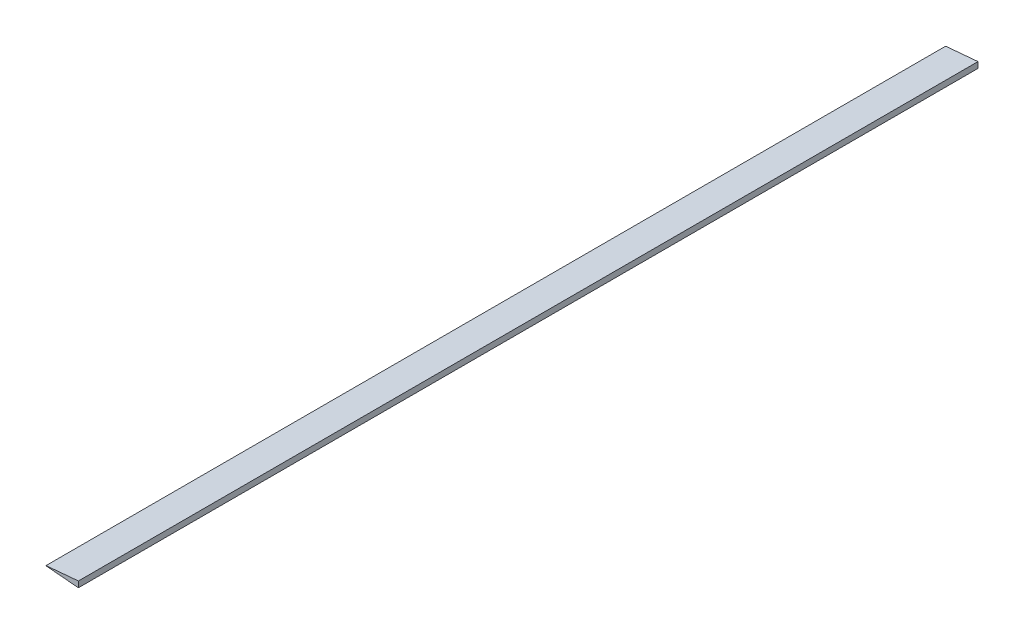
from build123d import *

# Parameters (mm, degrees)
BOSS_EXTRUDE1_DEPTH = 422.9


with BuildPart() as part:
    # Sketch1 → Boss-Extrude1 (new, symmetric)
    with BuildSketch(Plane.XY):
        with BuildLine():
            Line((-71.0668, 2.788978681), (-71.0668, -2.788978681))
            add(Edge.make_bspline(
                [(-71.0668, -2.788978681), (-71.180789757, -2.780935505), (-72.873449735, -2.661500548), (-76.05100549, -2.415421445), (-80.490955936, -2.060949656), (-84.605020273, -1.712894337), (-88.348332728, -1.382028712), (-91.679826547, -1.075243647), (-94.563013415, -0.800090686), (-96.966306351, -0.56354481), (-98.86338481, -0.372017598), (-100.233471889, -0.23093643), (-101.061573115, -0.144551224), (-101.431307465, -0.105684166), (-101.524, -0.09594018)],
                knots=[0, 0, 0, 0, 0.011211572, 0.166483201, 0.31268616, 0.448210553, 0.571562716, 0.681381362, 0.776452467, 0.855722863, 0.918312437, 0.963524724, 0.990855635, 1, 1, 1, 1], degree=3))
            Line((-101.524, -0.09594018), (-101.524, 0.09594018))
            add(Edge.make_bspline(
                [(-71.0668, 2.788978681), (-71.180789757, 2.780935505), (-72.873449735, 2.661500548), (-76.05100549, 2.415421445), (-80.490955936, 2.060949656), (-84.605020273, 1.712894337), (-88.348332728, 1.382028712), (-91.679826547, 1.075243647), (-94.563013415, 0.800090686), (-96.966306351, 0.56354481), (-98.86338481, 0.372017598), (-100.233471889, 0.23093643), (-101.061573115, 0.144551224), (-101.431307465, 0.105684166), (-101.524, 0.09594018)],
                knots=[0, 0, 0, 0, 0.011211572, 0.166483201, 0.31268616, 0.448210553, 0.571562716, 0.681381362, 0.776452467, 0.855722863, 0.918312437, 0.963524724, 0.990855635, 1, 1, 1, 1], degree=3))
        make_face()
    extrude(amount=BOSS_EXTRUDE1_DEPTH, both=True)


solid = part.part
